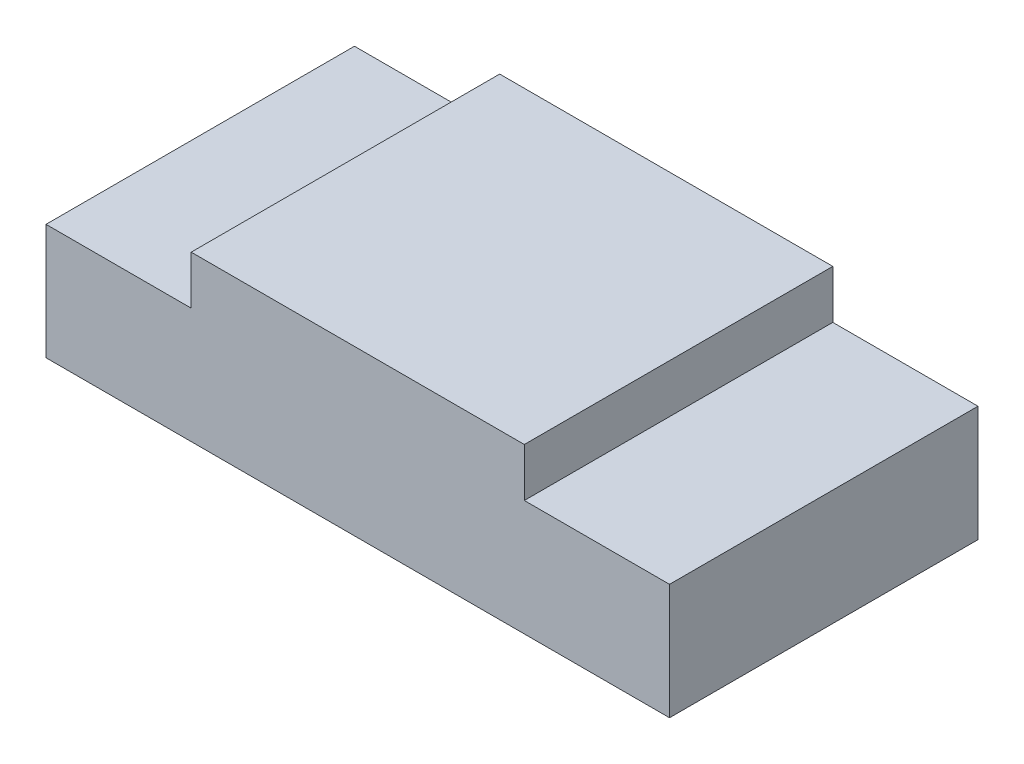
from build123d import *

# Parameters (mm, degrees)
SKETCH1_W      = 1206.5
SKETCH1_H      = 596.9
EXTRUDE1_DEPTH = 317.5
SKETCH2_W      = 280.957876244
SKETCH2_H      = 93.858968371
EXTRUDE2_DEPTH = 1350.289506876


with BuildPart() as part:
    # Sketch1 → Extrude1 (new body)
    with BuildSketch(Plane(origin=(0, 0, 0), x_dir=(1, 0, 0), z_dir=(0, 1, 0))):
        with Locations((564.434166787, -269.957526684)):
            Rectangle(SKETCH1_W, SKETCH1_H)
    extrude(amount=EXTRUDE1_DEPTH)

    # Sketch2 → Extrude2 (cut, through all)
    with BuildSketch(Plane.XY.offset(568.407526684)):
        with Locations((1027.205228665, 270.570515815)):
            Rectangle(SKETCH2_W, SKETCH2_H)
        with Locations((101.663104909, 270.570515815)):
            Rectangle(SKETCH2_W, SKETCH2_H)
    extrude(amount=-EXTRUDE2_DEPTH, mode=Mode.SUBTRACT)


solid = part.part
